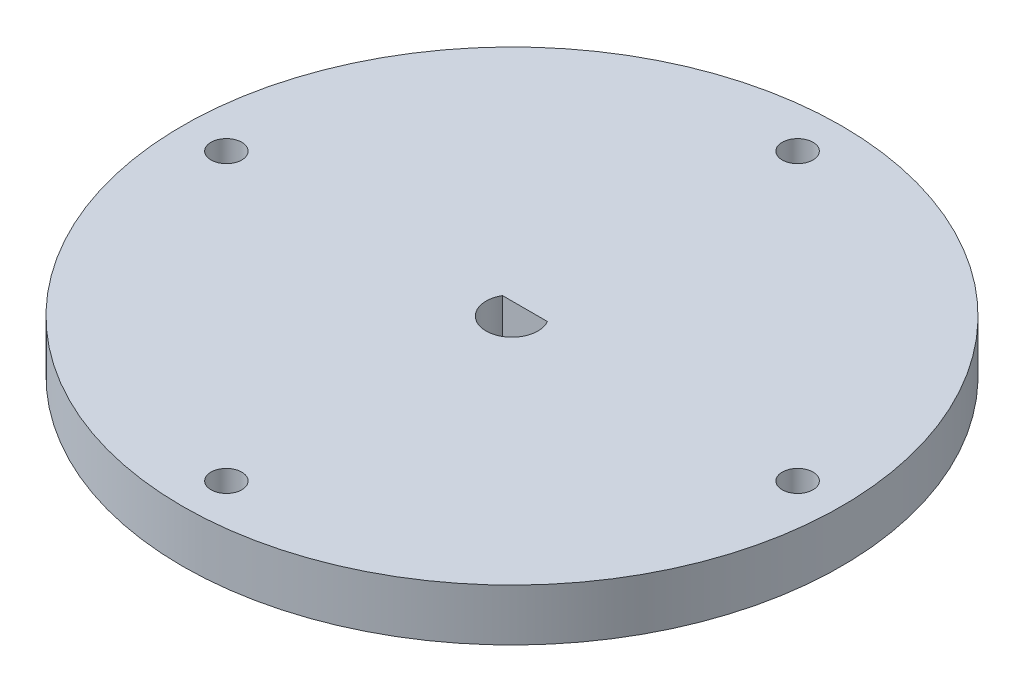
from build123d import *

# Parameters (mm, degrees)
SKETCH1_R           = 38.1
BOSS_EXTRUDE1_DEPTH = 6
SKETCH3_R           = 1.778
CUT_EXTRUDE1_DEPTH  = 55.214573686
CIRPATTERN1_COUNT   = 4
CUT_EXTRUDE2_DEPTH  = 55.214573686


with BuildPart() as part:
    # Sketch1 → Boss-Extrude1 (new body)
    with BuildSketch(Plane(origin=(0, 0, 0), x_dir=(1, 0, 0), z_dir=(0, 1, 0))):
        with Locations(Location((0, 0, 0), (0, 0, 270))):
            Circle(SKETCH1_R)
    extrude(amount=BOSS_EXTRUDE1_DEPTH)

    # Sketch3 → Cut-Extrude1 (cut, through all)
    with BuildSketch(Plane(origin=(0, 6, 0), x_dir=(1, 0, 0), z_dir=(0, 1, 0))):
        with Locations(Location((33.02, 0, 0), (0, 0, 270))):
            Circle(SKETCH3_R)
    cut_extrude1 = extrude(amount=-CUT_EXTRUDE1_DEPTH, mode=Mode.SUBTRACT)

    # CirPattern1: Cut-Extrude1 ×4 about axis
    cirpattern1_axis = Axis((0, 0, 0), (0, 1, 0))
    for i in range(1, CIRPATTERN1_COUNT):
        add(cut_extrude1.rotate(cirpattern1_axis, i * 360 / CIRPATTERN1_COUNT), mode=Mode.SUBTRACT)

    # Sketch4 → Cut-Extrude2 (cut, through all)
    with BuildSketch(Plane(origin=(0, 6, 0), x_dir=(1, 0, 0), z_dir=(0, 1, 0))):
        with BuildLine():
            Line((-2.598076211, 1.5), (2.598076211, 1.5))
            ThreePointArc((2.598076211, 1.5), (0, -3), (-2.598076211, 1.5))
        make_face()
    extrude(amount=-CUT_EXTRUDE2_DEPTH, mode=Mode.SUBTRACT)


solid = part.part
